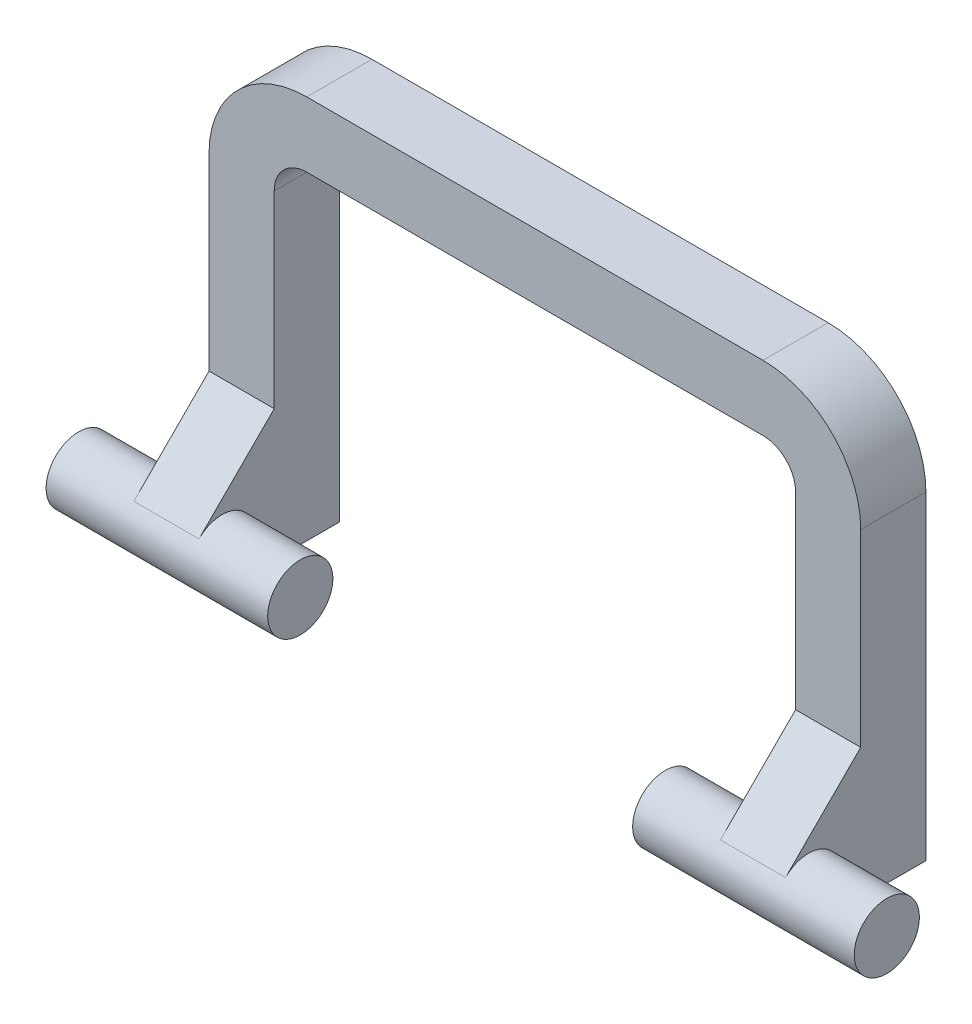
from build123d import *
from build123d.topology import SkipClean

# Parameters (mm, degrees)
EXTRUDE_1_DEPTH   = 10
EXTRUDE_1_2_DEPTH = 10
SKETCH_4_R        = 5
EXTRUDE_3_DEPTH   = 12
SKETCH_7_R        = 5
EXTRUDE_4_DEPTH   = 12


with BuildPart() as part:
    # 草图1 → Extrude 1 (new body)
    with BuildSketch(Plane.XY):
        with BuildLine():
            Line((50, 0), (50, 49))
            ThreePointArc((50, 49), (45.606601718, 59.606601718), (35, 64))
            Line((35, 64), (-35, 64))
            ThreePointArc((-35, 64), (-45.606601718, 59.606601718), (-50, 49))
            Line((-50, 49), (-50, 0))
            Line((-50, 0), (-40, 0))
            Line((-40, 0), (-40, 49))
            ThreePointArc((-40, 49), (-38.535533906, 52.535533906), (-35, 54))
            Line((-35, 54), (35, 54))
            ThreePointArc((35, 54), (38.535533906, 52.535533906), (40, 49))
            Line((40, 49), (40, 0))
            Line((40, 0), (50, 0))
        make_face()
    extrude(amount=EXTRUDE_1_DEPTH)

    # 草图2 → Extrude 1 2 (add)
    with BuildSketch(Plane(origin=(50, 0, 0), x_dir=(0, 0, -1), z_dir=(1, 0, 0))):
        with BuildLine():
            Line((0, 17.071067812), (0, 0))
            Line((0, 0), (-18, 0))
            ThreePointArc((-18, 0), (-22.619397663, 3.086582838), (-21.535533906, 8.535533906))
            Line((-21.535533906, 8.535533906), (-10, 20.071067812))
            Line((-10, 20.071067812), (0, 20.071067812))
            Line((0, 20.071067812), (0, 17.071067812))
        make_face()
    extrude_1_2 = extrude(amount=-EXTRUDE_1_2_DEPTH)

    # 草图4 → 凸台-拉伸3 (add)
    with BuildSketch(Plane.ZY.offset(-40)):
        with Locations(Location((18, 5, 0), (0, 0, 270))):
            Circle(SKETCH_4_R)
    extrude_3 = extrude(amount=EXTRUDE_3_DEPTH)

    # 镜向3: Extrude 1 2, 凸台-拉伸3 across plane
    add(extrude_1_2.mirror(Plane(origin=(0, 0, 0), x_dir=(0, 0, 1), z_dir=(1, 0, 0))))
    add(extrude_3.mirror(Plane(origin=(0, 0, 0), x_dir=(0, 0, 1), z_dir=(1, 0, 0))))

    # 草图7 → 凸台-拉伸4 (add)
    with SkipClean():  # the faces are left unmerged after this step: merging them gives an invalid solid
        with BuildSketch(Plane(origin=(50, 0, 0), x_dir=(0, 0, -1), z_dir=(1, 0, 0))):
            with Locations((-18, 5)):
                Circle(SKETCH_7_R)
        extrude_4 = extrude(amount=EXTRUDE_4_DEPTH)

    # 镜向4: 凸台-拉伸4 across plane
    with SkipClean():  # the faces are left unmerged after this step: merging them gives an invalid solid
        add(extrude_4.mirror(Plane(origin=(0, 0, 0), x_dir=(0, 0, 1), z_dir=(1, 0, 0))))


solid = part.part
